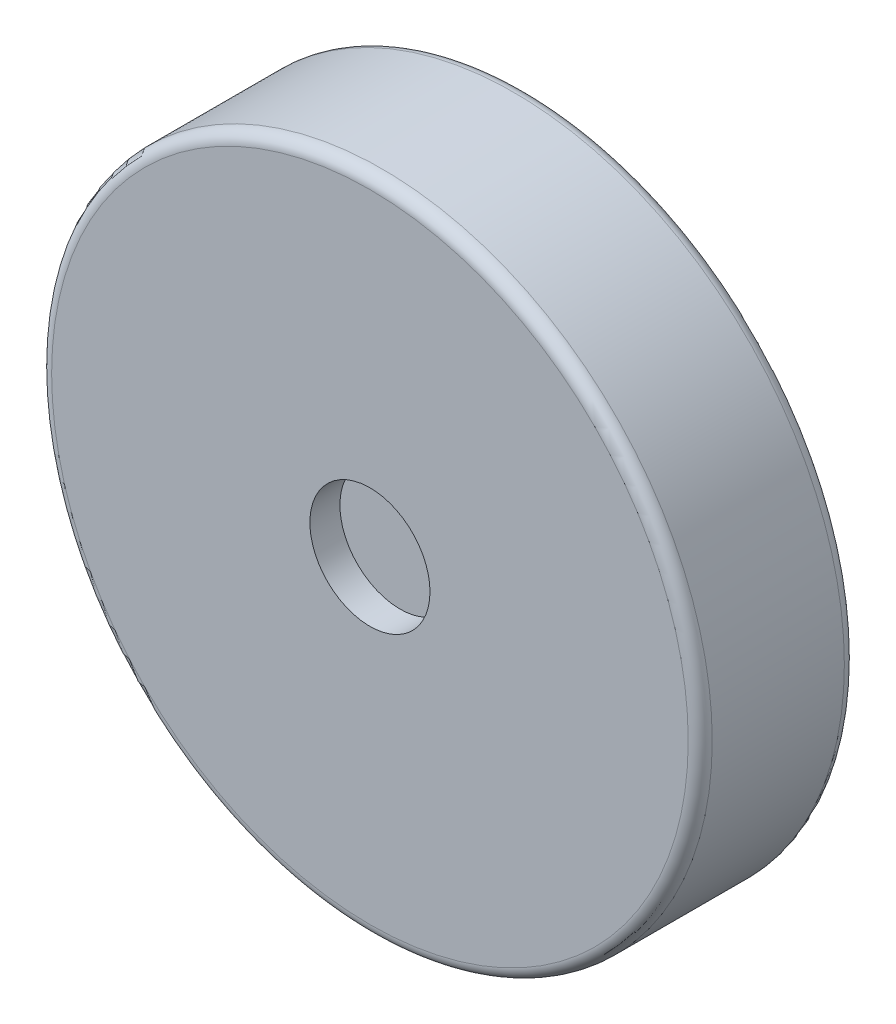
from build123d import *

# Parameters (mm, degrees)
SKETCH1_R           = 55
BOSS_EXTRUDE1_DEPTH = 26
SKETCH2_R           = 1.5
CUT_EXTRUDE1_DEPTH  = 3
SKETCH3_R           = 32.5
BOSS_EXTRUDE2_DEPTH = 8
SKETCH4_R           = 2.55
SKETCH4_R_2         = 1.55
SKETCH4_R_3         = 2.05
CUT_EXTRUDE2_DEPTH  = 3
FILLET1_R           = 2
SKETCH9_R           = 42.415927499
CUT_EXTRUDE3_DEPTH  = 83.012194282
SKETCH10_R          = 10
CUT_EXTRUDE4_DEPTH  = 5


with BuildPart() as part:
    # Sketch1 → Boss-Extrude1 (new body)
    with BuildSketch(Plane.XY):
        with Locations(Location((0, 0, 0), (0, 0, 180))):
            Circle(SKETCH1_R)
    extrude(amount=BOSS_EXTRUDE1_DEPTH)

    # Sketch2 → Cut-Extrude1 (cut)
    with BuildSketch(Plane(origin=(0, 0, 0), x_dir=(-1, 0, 0), z_dir=(0, 0, -1))):
        with Locations((0, -21)):
            Circle(SKETCH2_R)
        with Locations((-14.849242405, -14.849242405)):
            Circle(SKETCH2_R)
        with Locations((-21, 0)):
            Circle(SKETCH2_R)
        with Locations((-14.849242405, 14.849242405)):
            Circle(SKETCH2_R)
        with Locations((0, 21)):
            Circle(SKETCH2_R)
        with Locations((14.849242405, 14.849242405)):
            Circle(SKETCH2_R)
        with Locations((21, 0)):
            Circle(SKETCH2_R)
        with Locations((14.849242405, -14.849242405)):
            Circle(SKETCH2_R)
    extrude(amount=-CUT_EXTRUDE1_DEPTH, mode=Mode.SUBTRACT)

    # Sketch3 → Boss-Extrude2 (add)
    with BuildSketch(Plane.XY.offset(26)):
        Circle(SKETCH3_R)
    extrude(amount=BOSS_EXTRUDE2_DEPTH)

    # Sketch4 → Cut-Extrude2 (cut)
    with BuildSketch(Plane.XY.offset(34)):
        with Locations((-16.5, 0)):
            Circle(SKETCH4_R)
        with Locations((0, -16.5)):
            Circle(SKETCH4_R)
        with Locations((16.5, 0)):
            Circle(SKETCH4_R)
        with Locations((0, 16.5)):
            Circle(SKETCH4_R)
        with Locations((0, 26)):
            Circle(SKETCH4_R_2)
        with Locations((0, 22)):
            Circle(SKETCH4_R_2)
        with Locations((-11.66726189, -11.66726189)):
            Circle(SKETCH4_R_3)
        with Locations((11.66726189, -11.66726189)):
            Circle(SKETCH4_R_3)
        with Locations((11.66726189, 11.66726189)):
            Circle(SKETCH4_R_3)
        with Locations((-11.66726189, 11.66726189)):
            Circle(SKETCH4_R_3)
        with Locations((-22, 0)):
            Circle(SKETCH4_R_2)
        with Locations((-26, 0)):
            Circle(SKETCH4_R_2)
        with Locations((0, -22)):
            Circle(SKETCH4_R_2)
        with Locations((0, -26)):
            Circle(SKETCH4_R_2)
        with Locations((22, 0)):
            Circle(SKETCH4_R_2)
        with Locations((26, 0)):
            Circle(SKETCH4_R_2)
    extrude(amount=-CUT_EXTRUDE2_DEPTH, mode=Mode.SUBTRACT)

    # Fillet1
    fillet1_edges = [part.edges().sort_by_distance(p)[0] for p in [
        (55, 0, 0),
        (55, 0, 26),
    ]]
    fillet(fillet1_edges, radius=FILLET1_R)

    # Sketch9 → Cut-Extrude3 (cut, through all)
    with BuildSketch(Plane.XY.offset(26)):
        Circle(SKETCH9_R)
    extrude(amount=CUT_EXTRUDE3_DEPTH, mode=Mode.SUBTRACT)

    # Sketch10 → Cut-Extrude4 (cut)
    with BuildSketch(Plane.XY.offset(26)):
        Circle(SKETCH10_R)
    extrude(amount=-CUT_EXTRUDE4_DEPTH, mode=Mode.SUBTRACT)


solid = part.part
